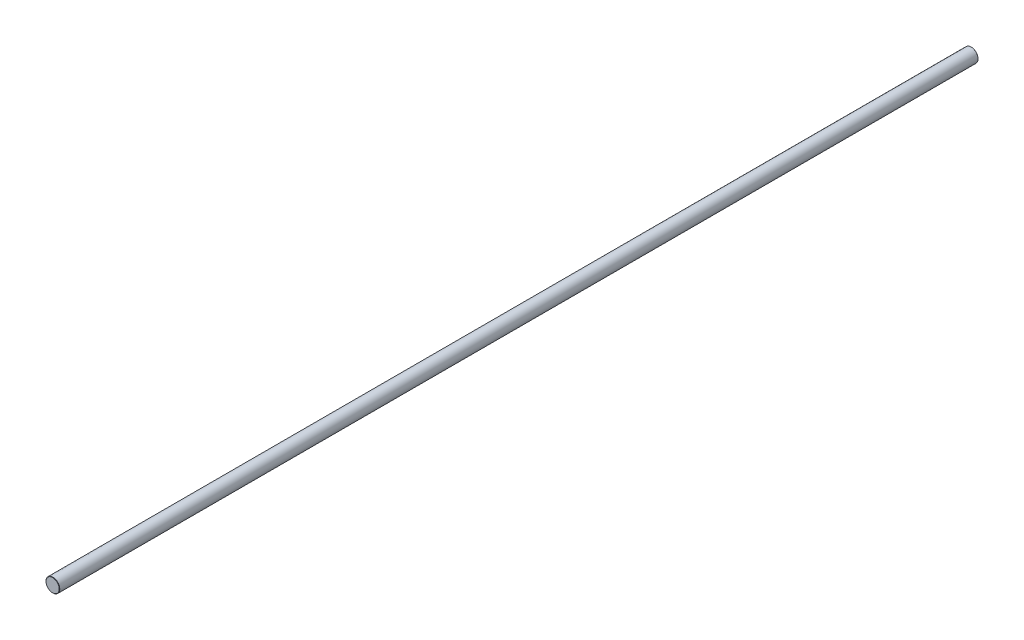
from build123d import *

# Parameters (mm, degrees)
BOSS_EXTRUDE1_DEPTH      = 200
BOSS_EXTRUDE1_DEPTH_BACK = 200
SKETCH3_R                = 3
CHAMFER1_SIZE            = 0.12


with BuildPart() as part:
    # Sketch3 → Boss-Extrude1 (new, two sides: drawn at the far end of the back side and taken through both)
    with BuildSketch(Plane.XY.offset(-BOSS_EXTRUDE1_DEPTH_BACK)):
        Circle(SKETCH3_R)
    extrude(amount=BOSS_EXTRUDE1_DEPTH + BOSS_EXTRUDE1_DEPTH_BACK)

    # Chamfer1
    chamfer1_edges = [part.edges().sort_by_distance(p)[0] for p in [
        (-3, 0, -200),
        (-3, 0, 200),
    ]]
    chamfer(chamfer1_edges, length=CHAMFER1_SIZE)


solid = part.part
